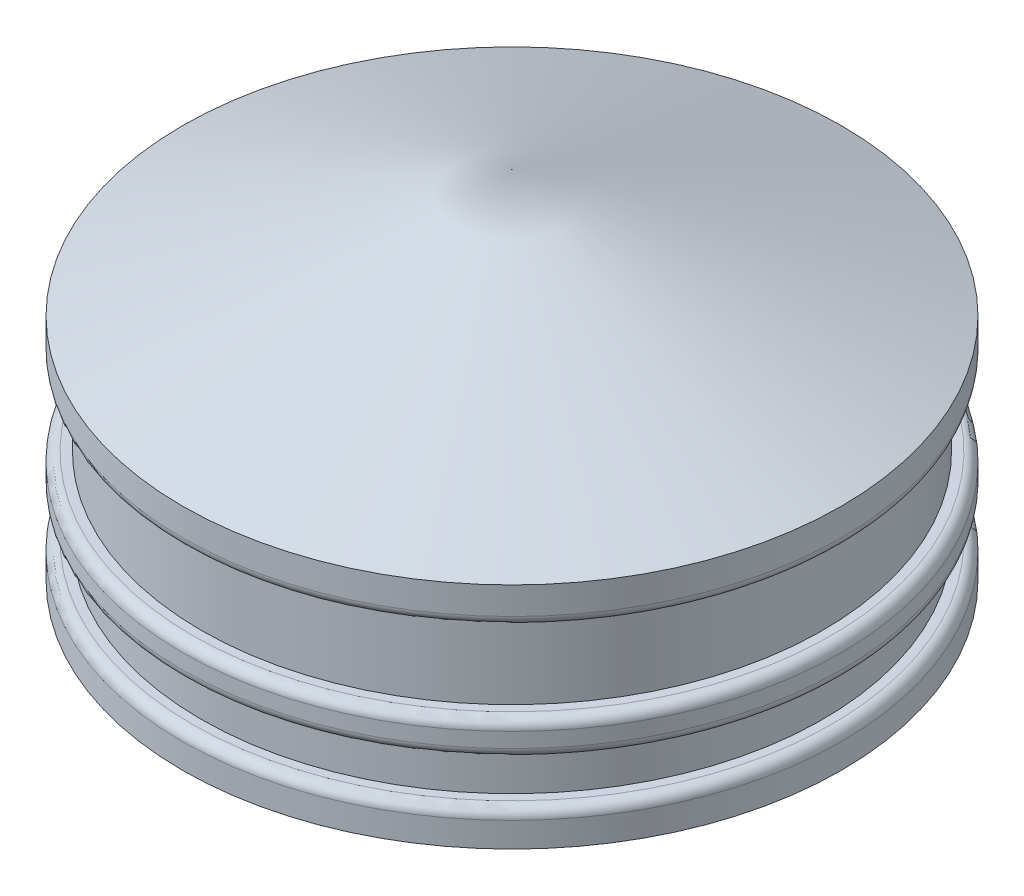
from build123d import *

# Parameters (mm, degrees)
SKETCH3_R          = 13.25
SKETCH3_R_2        = 12.5
CUT_EXTRUDE1_DEPTH = 1.7
SKETCH4_R          = 13.25
SKETCH4_R_2        = 12.5
CUT_EXTRUDE2_DEPTH = 3.2
FILLET1_R          = 0.4


with BuildPart() as part:
    # Sketch2 → Revolve1 (revolve)
    with BuildSketch(Plane(origin=(0, 0, 0), x_dir=(0, 0, -1), z_dir=(1, 0, 0))):
        Polygon((0, 14.3), (13.25, 9.2), (13.25, 0), (8.15, 0), (8.15, 3.5), (9.75, 3.5), (9.75, 6.796854291), (0, 10.54968448), align=None)
    revolve(axis=Axis((0, -0.715, 0), (0, 1, 0)))

    # Sketch3 → Cut-Extrude1 (cut)
    with BuildSketch(Plane(origin=(0, 1.4, 0), x_dir=(1, 0, 0), z_dir=(0, 1, 0))):
        with Locations(Location((0, 0, 0), (0, 0, 90))):
            Circle(SKETCH3_R)
        with Locations(Location((0, 0, 0), (0, 0, 270))):
            Circle(SKETCH3_R_2, mode=Mode.SUBTRACT)
    extrude(amount=CUT_EXTRUDE1_DEPTH, mode=Mode.SUBTRACT)

    # Sketch4 → Cut-Extrude2 (cut)
    with BuildSketch(Plane(origin=(0, 4.5, 0), x_dir=(1, 0, 0), z_dir=(0, 1, 0))):
        with Locations(Location((0, 0, 0), (0, 0, 270))):
            Circle(SKETCH4_R)
        with Locations(Location((0, 0, 0), (0, 0, 270))):
            Circle(SKETCH4_R_2, mode=Mode.SUBTRACT)
    extrude(amount=CUT_EXTRUDE2_DEPTH, mode=Mode.SUBTRACT)

    # Fillet1
    fillet1_edges = [part.edges().sort_by_distance(p)[0] for p in [
        (0, 3.1, 13.25),
        (0, 1.4, 13.25),
        (0, 7.7, 13.25),
        (0, 4.5, 13.25),
    ]]
    fillet(fillet1_edges, radius=FILLET1_R)


solid = part.part
